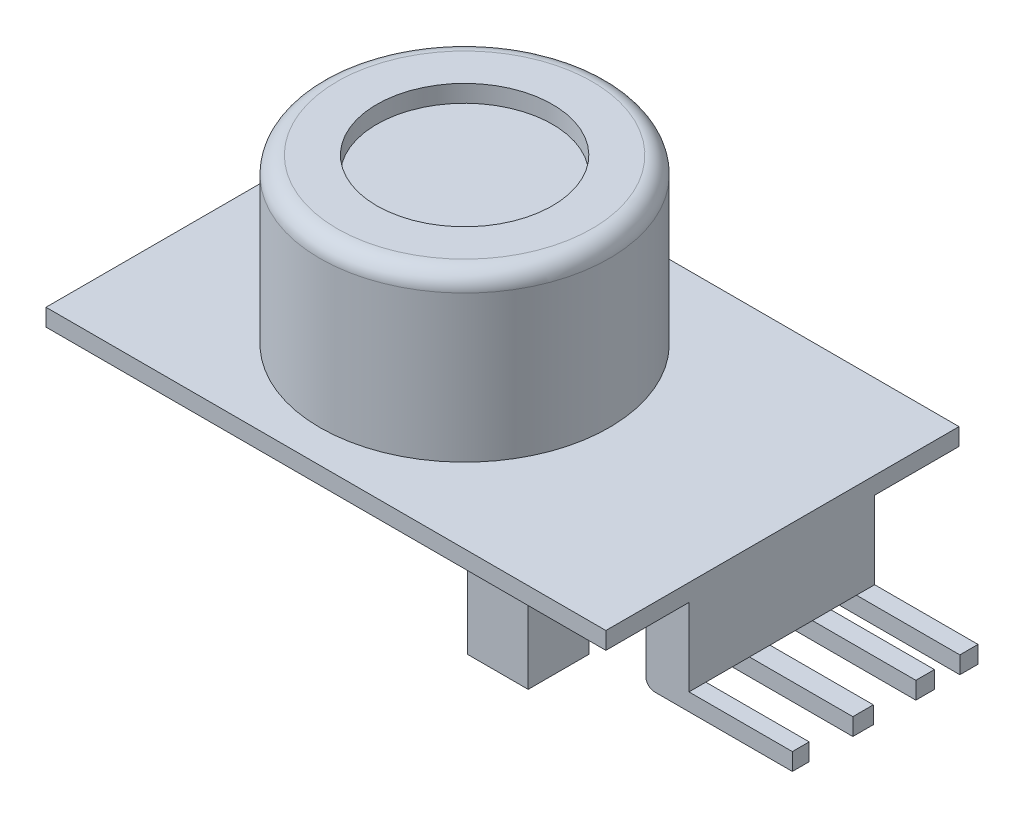
from build123d import *

# Parameters (mm, degrees)
CROQUIS1_W              = 32.5
CROQUIS1_H              = 20.5
SALIENTE_EXTRUIR1_DEPTH = 1
CROQUIS2_R              = 8.4
SALIENTE_EXTRUIR2_DEPTH = 9.5
CROQUIS3_W              = 2.5
CROQUIS3_H              = 10.77685143
SALIENTE_EXTRUIR3_DEPTH = 5.5
CROQUIS4_W              = 10.77685143
CROQUIS4_H              = 1
SALIENTE_EXTRUIR4_DEPTH = 6
CROQUIS5_W              = 3.536132023
CROQUIS5_H              = 3.536132023
SALIENTE_EXTRUIR5_DEPTH = 5
CROQUIS7_R              = 5.1
CORTAR_EXTRUIR1_DEPTH   = 1
REDONDEO1_R             = 1
CROQUIS8_W              = 2.533189813
CROQUIS8_H              = 1
CROQUIS8_W_2            = 2.4671066
CROQUIS8_W_3            = 1.475858413
CORTAR_EXTRUIR2_DEPTH   = 12
REDONDEO2_R             = 0.5


with BuildPart() as part:
    # Croquis1 → Saliente-Extruir1 (new body)
    with BuildSketch(Plane(origin=(0, 0, 0), x_dir=(1, 0, 0), z_dir=(0, 1, 0))):
        with Locations((16.25, 10.25)):
            Rectangle(CROQUIS1_W, CROQUIS1_H)
    extrude(amount=SALIENTE_EXTRUIR1_DEPTH)

    # Croquis2 → Saliente-Extruir2 (add)
    with BuildSketch(Plane(origin=(0, 1, 0), x_dir=(1, 0, 0), z_dir=(0, 1, 0))):
        with Locations(Location((14, 10.3, 0), (0, 0, 270))):
            Circle(CROQUIS2_R)
    extrude(amount=SALIENTE_EXTRUIR2_DEPTH)

    # Croquis3 → Saliente-Extruir3 (add)
    with BuildSketch(Plane.XZ):
        with Locations((31.25, -10.213198871)):
            Rectangle(CROQUIS3_W, CROQUIS3_H)
    extrude(amount=SALIENTE_EXTRUIR3_DEPTH)

    # Croquis4 → Saliente-Extruir4 (add)
    with BuildSketch(Plane(origin=(32.5, 0, 0), x_dir=(0, 0, -1), z_dir=(1, 0, 0))):
        with Locations((10.213198871, -5)):
            Rectangle(CROQUIS4_W, CROQUIS4_H)
    extrude(amount=SALIENTE_EXTRUIR4_DEPTH)

    # Croquis5 → Saliente-Extruir5 (add)
    with BuildSketch(Plane.XZ):
        with Locations((25.43823104, -2.55154591)):
            Rectangle(CROQUIS5_W, CROQUIS5_H)
    extrude(amount=SALIENTE_EXTRUIR5_DEPTH)

    # Croquis7 → Cortar-Extruir1 (cut)
    with BuildSketch(Plane(origin=(0, 10.5, 0), x_dir=(1, 0, 0), z_dir=(0, 1, 0))):
        with Locations(Location((14, 10.3, 0), (0, 0, 270))):
            Circle(CROQUIS7_R)
    extrude(amount=-CORTAR_EXTRUIR1_DEPTH, mode=Mode.SUBTRACT)

    # Redondeo1
    redondeo1_edges = [part.edges().sort_by_distance(p)[0] for p in [
        (14, 10.5, -18.7),
    ]]
    fillet(redondeo1_edges, radius=REDONDEO1_R)

    # Croquis8 → Cortar-Extruir2 (cut)
    with BuildSketch(Plane(origin=(38.5, 0, 0), x_dir=(0, 0, -1), z_dir=(1, 0, 0))):
        with Locations((7.06995271, -5)):
            Rectangle(CROQUIS8_W, CROQUIS8_H)
        with Locations((10.759598741, -5)):
            Rectangle(CROQUIS8_W_2, CROQUIS8_H)
        with Locations((13.810440385, -5)):
            Rectangle(CROQUIS8_W_3, CROQUIS8_H)
    extrude(amount=-CORTAR_EXTRUIR2_DEPTH, mode=Mode.SUBTRACT)

    # Redondeo2
    redondeo2_edges = [part.edges().sort_by_distance(p)[0] for p in [
        (30, -5.5, -5.31406548),
        (30, -5.5, -8.931296528),
        (30, -5.5, -12.53283161),
        (30, -5.5, -15.074997088),
    ]]
    fillet(redondeo2_edges, radius=REDONDEO2_R)


solid = part.part
